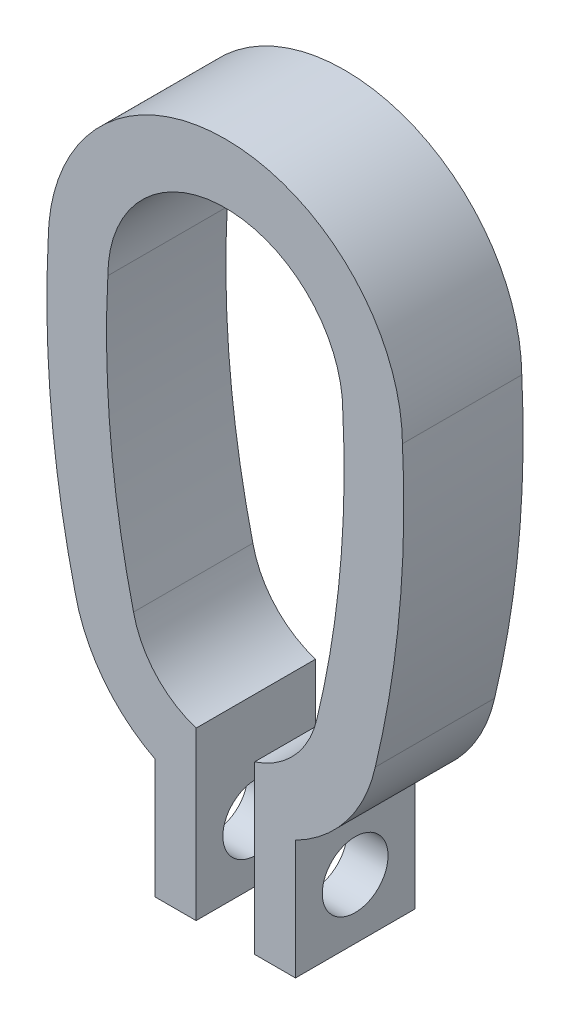
from build123d import *

# Parameters (mm, degrees)
BOSS_EXTRUDE1_DEPTH = 12.7
SKETCH2_R           = 3.499999985
CUT_EXTRUDE1_DEPTH  = 127


with BuildPart() as part:
    # Sketch1 → Boss-Extrude1 (new body)
    with BuildSketch(Plane.XY):
        with BuildLine():
            Line((-3.110307402, -37.00399852), (-3.110307402, -54.746228005))
            Line((-3.110307402, -54.746228005), (-7.465236153, -54.746228005))
            Line((-7.465236153, -54.746228005), (-7.465236153, -42.046228005))
            ThreePointArc((-7.465236153, -42.046228005), (-12.933427118, -37.502447849), (-15.956082844, -31.067340787))
            ThreePointArc((-15.956082844, -31.067340787), (-18.522349701, -15.547297089), (-18.849139709, 0.180089543))
            ThreePointArc((-18.849139709, 0.180089543), (0, 18.85), (18.849139709, 0.180089543))
            ThreePointArc((18.849139709, 0.180089543), (18.522349701, -15.547297089), (15.956082844, -31.067340787))
            ThreePointArc((15.956082844, -31.067340787), (12.933427118, -37.502447849), (7.465236153, -42.046228005))
            Line((7.465236153, -42.046228005), (7.465236153, -54.746228005))
            Line((7.465236153, -54.746228005), (3.110307402, -54.746228005))
            Line((3.110307402, -54.746228005), (3.110307402, -37.00399852))
            ThreePointArc((3.110307402, -37.00399852), (7.417993382, -34.206219068), (9.768536138, -29.639088993))
            ThreePointArc((9.768536138, -29.639088993), (12.203438759, -14.918076577), (12.5, 0))
            ThreePointArc((12.5, 0), (0, 12.5), (-12.5, 0))
            ThreePointArc((-12.5, 0), (-12.203438759, -14.918076577), (-9.768536138, -29.639088993))
            ThreePointArc((-9.768536138, -29.639088993), (-7.417993382, -34.206219068), (-3.110307402, -37.00399852))
        make_face()
    extrude(amount=BOSS_EXTRUDE1_DEPTH)

    # Sketch2 → Cut-Extrude1 (cut)
    with BuildSketch(Plane(origin=(7.465236153, 0, 0), x_dir=(0, 0, -1), z_dir=(1, 0, 0))):
        with Locations(Location((-6.35, -48.396228005, 0), (0, 0, 90))):
            Circle(SKETCH2_R)
    extrude(amount=-CUT_EXTRUDE1_DEPTH, mode=Mode.SUBTRACT)


solid = part.part
